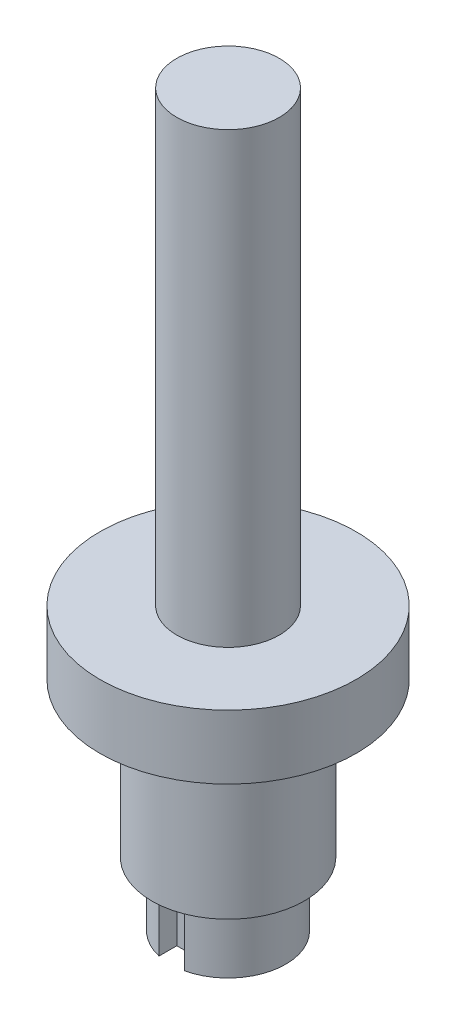
from build123d import *

# Parameters (mm, degrees)
SKETCH2_R                   = 4.5
BOSS_EXTRUDE1_DEPTH         = 5
SKETCH3_R                   = 5.95
BOSS_EXTRUDE2_DEPTH         = 12
SKETCH4_R                   = 10
BOSS_EXTRUDE3_DEPTH         = 5
M3_TAPPED_HOLE1_D           = 2.5
M3_TAPPED_HOLE1_CSINK_D     = 3.05
M3_TAPPED_HOLE1_CSINK_ANGLE = 90
SKETCH11_W                  = 2
SKETCH11_H                  = 3
CUT_EXTRUDE2_DEPTH          = 5
SKETCH12_R                  = 4
BOSS_EXTRUDE5_DEPTH         = 35


with BuildPart() as part:
    # Sketch2 → Boss-Extrude1 (new body)
    with BuildSketch(Plane(origin=(0, 0, 0), x_dir=(1, 0, 0), z_dir=(0, 1, 0))):
        with Locations(Location((0, 0, 0), (0, 0, 270))):
            Circle(SKETCH2_R)
    extrude(amount=BOSS_EXTRUDE1_DEPTH)

    # Sketch3 → Boss-Extrude2 (add)
    with BuildSketch(Plane(origin=(0, 5, 0), x_dir=(1, 0, 0), z_dir=(0, 1, 0))):
        with Locations(Location((0, 0, 0), (0, 0, 270))):
            Circle(SKETCH3_R)
    extrude(amount=BOSS_EXTRUDE2_DEPTH)

    # Sketch4 → Boss-Extrude3 (add)
    with BuildSketch(Plane(origin=(0, 17, 0), x_dir=(1, 0, 0), z_dir=(0, 1, 0))):
        with Locations(Location((0, 0, 0), (0, 0, 270))):
            Circle(SKETCH4_R)
    extrude(amount=BOSS_EXTRUDE3_DEPTH)

    # M3 Tapped Hole1 (through all)
    with Locations(Plane(origin=(0, 0, 0), x_dir=(-1, 0, 0), z_dir=(0, -1, 0))):
        with Locations((0, 0)):
            CounterSinkHole(M3_TAPPED_HOLE1_D / 2, M3_TAPPED_HOLE1_CSINK_D / 2, counter_sink_angle=M3_TAPPED_HOLE1_CSINK_ANGLE)

    # Sketch11 → Cut-Extrude2 (cut)
    with BuildSketch(Plane.XZ):
        with Locations((0, 4.5)):
            Rectangle(SKETCH11_W, SKETCH11_H)
    extrude(amount=-CUT_EXTRUDE2_DEPTH, mode=Mode.SUBTRACT)

    # Sketch12 → Boss-Extrude5 (add)
    with BuildSketch(Plane(origin=(0, 22, 0), x_dir=(1, 0, 0), z_dir=(0, 1, 0))):
        with Locations(Location((0, 0, 0), (0, 0, 270))):
            Circle(SKETCH12_R)
    extrude(amount=BOSS_EXTRUDE5_DEPTH)


solid = part.part
